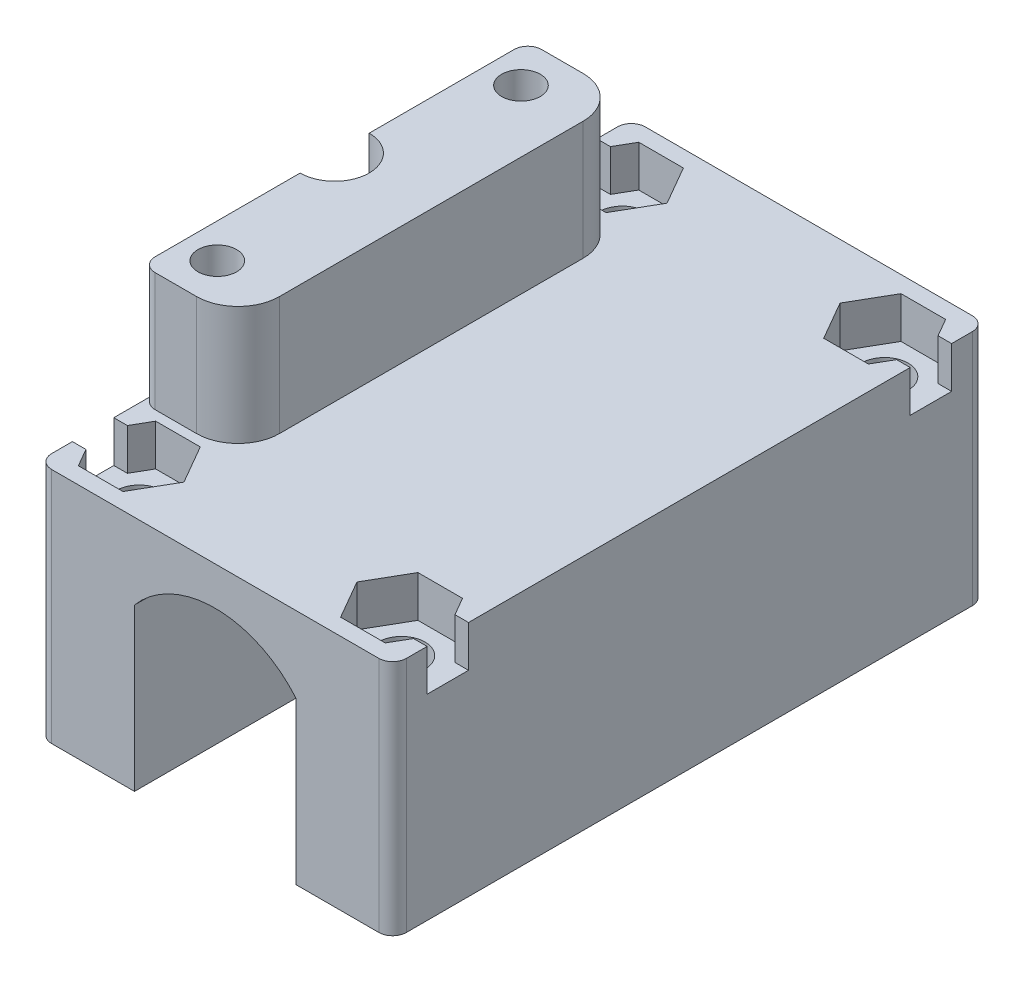
from build123d import *

# Parameters (mm, degrees)
EXTRUDE_1_DEPTH     = 43
EXTRUDE_2_DEPTH     = 8.6
SKETCH_3_R          = 1.4
CUT_EXTRUDE_1_DEPTH = 15
CUT_EXTRUDE_START   = -17.2
SKETCH_4_R          = 2.5
CUT_EXTRUDE_2_DEPTH = 17.2
SKETCH_5_W          = 5
SKETCH_5_H          = 10
CUT_EXTRUDE_3_DEPTH = 15
SKETCH_6_R          = 1.7
CUT_EXTRUDE_4_DEPTH = 20
CUT_EXTRUDE_START_2 = -3
SKETCH_7_W          = 2.192810324
SKETCH_7_H          = 3
SKETCH_7_R          = 1.7
CUT_EXTRUDE_5_DEPTH = 3
FILLET_1_R          = 3
FILLET_2_R          = 1


with BuildPart() as part:
    # Эскиз1 → Бобышка-Вытянуть1 (new body)
    with BuildSketch(Plane.XY):
        with BuildLine():
            Line((5.85, 0), (5.85, 11.699503018))
            ThreePointArc((5.85, 11.699503018), (0, 14.42), (-5.85, 11.699503018))
            Line((-5.85, 11.699503018), (-5.85, 0))
            Line((-5.85, 0), (-12.85, 0))
            Line((-12.85, 0), (-12.85, 17.2))
            Line((-12.85, 17.2), (12.85, 17.2))
            Line((12.85, 17.2), (12.85, 0))
            Line((12.85, 0), (5.85, 0))
        make_face()
    extrude(amount=EXTRUDE_1_DEPTH)

    # Эскиз2 → Бобышка-Вытянуть2 (add)
    with BuildSketch(Plane(origin=(0, 17.2, 0), x_dir=(1, 0, 0), z_dir=(0, 1, 0))):
        with BuildLine():
            Line((-12.85, -7.5), (-8.85, -7.5))
            ThreePointArc((-8.85, -7.5), (-6.728679656, -8.378679656), (-5.85, -10.5))
            Line((-5.85, -10.5), (-5.85, -32.5))
            ThreePointArc((-5.85, -32.5), (-6.728679656, -34.621320344), (-8.85, -35.5))
            Line((-8.85, -35.5), (-12.85, -35.5))
            Line((-12.85, -35.5), (-12.85, -24))
            ThreePointArc((-12.85, -24), (-10.35, -21.5), (-12.85, -19))
            Line((-12.85, -19), (-12.85, -7.5))
        make_face()
    extrude(amount=EXTRUDE_2_DEPTH)

    # Эскиз3 → Вырез-Вытянуть1 (cut)
    with BuildSketch(Plane(origin=(0, 25.8, 0), x_dir=(1, 0, 0), z_dir=(0, 1, 0))):
        with Locations(Location((-10.35, -10.5, 0), (0, 0, 270))):
            Circle(SKETCH_3_R)
        with Locations(Location((-10.35, -32.5, 0), (0, 0, 90))):
            Circle(SKETCH_3_R)
    extrude(amount=-CUT_EXTRUDE_1_DEPTH, mode=Mode.SUBTRACT)

    # Эскиз4 → Вырез-Вытянуть2 (cut)
    with BuildSketch(Plane(origin=(0, 17.2, 0), x_dir=(1, 0, 0), z_dir=(0, 1, 0)).offset(CUT_EXTRUDE_START)):
        with Locations((-12.85, -21.5)):
            Circle(SKETCH_4_R)
    extrude(amount=CUT_EXTRUDE_2_DEPTH, mode=Mode.SUBTRACT)

    # Эскиз5 → Вырез-Вытянуть3 (cut)
    with BuildSketch(Plane.ZY.offset(12.85)):
        with Locations((21.5, 5)):
            Rectangle(SKETCH_5_W, SKETCH_5_H)
    extrude(amount=-CUT_EXTRUDE_3_DEPTH, mode=Mode.SUBTRACT)

    # Эскиз6 → Вырез-Вытянуть4 (cut)
    with BuildSketch(Plane.XZ):
        with Locations((9.5, 39)):
            Circle(SKETCH_6_R)
        with Locations(Location((-9.5, 39, 0), (0, 0, 270))):
            Circle(SKETCH_6_R)
        with Locations(Location((9.5, 4, 0), (0, 0, 270))):
            Circle(SKETCH_6_R)
        with Locations((-9.5, 4)):
            Circle(SKETCH_6_R)
    extrude(amount=-CUT_EXTRUDE_4_DEPTH, mode=Mode.SUBTRACT)

    # Эскиз7 → Вырез-Вытянуть5 (cut)
    # profile 1 of 8: a face of its own
    with BuildSketch(Plane(origin=(0, 17.2, 0), x_dir=(1, 0, 0), z_dir=(0, 1, 0)).offset(CUT_EXTRUDE_START_2)):
        with Locations((-13.946405162, -4)):
            Rectangle(SKETCH_7_W, SKETCH_7_H)
    # profile 2 of 8: a face of its own
    with BuildSketch(Plane(origin=(0, 17.2, 0), x_dir=(1, 0, 0), z_dir=(0, 1, 0)).offset(CUT_EXTRUDE_START_2)):
        Polygon((-12.85, -5.5), (-11.867136104, -5.5), (-11.116580754, -6.8), (-7.883419246, -6.8), (-6.266838493, -4), (-7.883419246, -1.2), (-11.116580754, -1.2), (-11.867136104, -2.5), (-12.85, -2.5), align=None)
        with Locations((-9.5, -4)):
            Circle(SKETCH_7_R, mode=Mode.SUBTRACT)
    # profile 3 of 8: a face of its own
    with BuildSketch(Plane(origin=(0, 17.2, 0), x_dir=(1, 0, 0), z_dir=(0, 1, 0)).offset(CUT_EXTRUDE_START_2)):
        Polygon((12.85, -5.5), (12.85, -2.5), (11.867136104, -2.5), (11.116580754, -1.2), (7.883419246, -1.2), (6.266838493, -4), (7.883419246, -6.8), (11.116580754, -6.8), (11.867136104, -5.5), align=None)
        with Locations(Location((9.5, -4, 0), (0, 0, 270))):
            Circle(SKETCH_7_R, mode=Mode.SUBTRACT)
    # profile 4 of 8: a face of its own
    with BuildSketch(Plane(origin=(0, 17.2, 0), x_dir=(1, 0, 0), z_dir=(0, 1, 0)).offset(CUT_EXTRUDE_START_2)):
        with Locations((13.946405162, -4)):
            Rectangle(SKETCH_7_W, SKETCH_7_H)
    # profile 5 of 8: a face of its own
    with BuildSketch(Plane(origin=(0, 17.2, 0), x_dir=(1, 0, 0), z_dir=(0, 1, 0)).offset(CUT_EXTRUDE_START_2)):
        with Locations((13.946405162, -39)):
            Rectangle(SKETCH_7_W, SKETCH_7_H)
    # profile 6 of 8: a face of its own
    with BuildSketch(Plane(origin=(0, 17.2, 0), x_dir=(1, 0, 0), z_dir=(0, 1, 0)).offset(CUT_EXTRUDE_START_2)):
        Polygon((12.85, -40.5), (12.85, -37.5), (11.867136104, -37.5), (11.116580754, -36.2), (7.883419246, -36.2), (6.266838493, -39), (7.883419246, -41.8), (11.116580754, -41.8), (11.867136104, -40.5), align=None)
        with Locations((9.5, -39)):
            Circle(SKETCH_7_R, mode=Mode.SUBTRACT)
    # profile 7 of 8: a face of its own
    with BuildSketch(Plane(origin=(0, 17.2, 0), x_dir=(1, 0, 0), z_dir=(0, 1, 0)).offset(CUT_EXTRUDE_START_2)):
        Polygon((-11.867136104, -37.5), (-12.85, -37.5), (-12.85, -40.5), (-11.867136104, -40.5), (-11.116580754, -41.8), (-7.883419246, -41.8), (-6.266838493, -39), (-7.883419246, -36.2), (-11.116580754, -36.2), align=None)
        with Locations(Location((-9.5, -39, 0), (0, 0, 270))):
            Circle(SKETCH_7_R, mode=Mode.SUBTRACT)
    # profile 8 of 8: a face of its own
    with BuildSketch(Plane(origin=(0, 17.2, 0), x_dir=(1, 0, 0), z_dir=(0, 1, 0)).offset(CUT_EXTRUDE_START_2)):
        with Locations((-13.946405162, -39)):
            Rectangle(SKETCH_7_W, SKETCH_7_H)
    extrude(amount=CUT_EXTRUDE_5_DEPTH, mode=Mode.SUBTRACT)

    # Скругление1
    fillet_1_edges = [part.edges().sort_by_distance(p)[0] for p in [
        (-5.85, 5, 24),
        (-5.85, 5, 19),
    ]]
    fillet(fillet_1_edges, radius=FILLET_1_R)

    # Скругление2
    fillet_2_edges = [part.edges().sort_by_distance(p)[0] for p in [
        (12.85, 8.6, 0),
        (-12.85, 8.6, 0),
        (12.85, 8.6, 43),
        (-12.85, 8.6, 43),
        (-12.85, 21.5, 35.5),
        (-12.85, 21.5, 7.5),
    ]]
    fillet(fillet_2_edges, radius=FILLET_2_R)


solid = part.part
